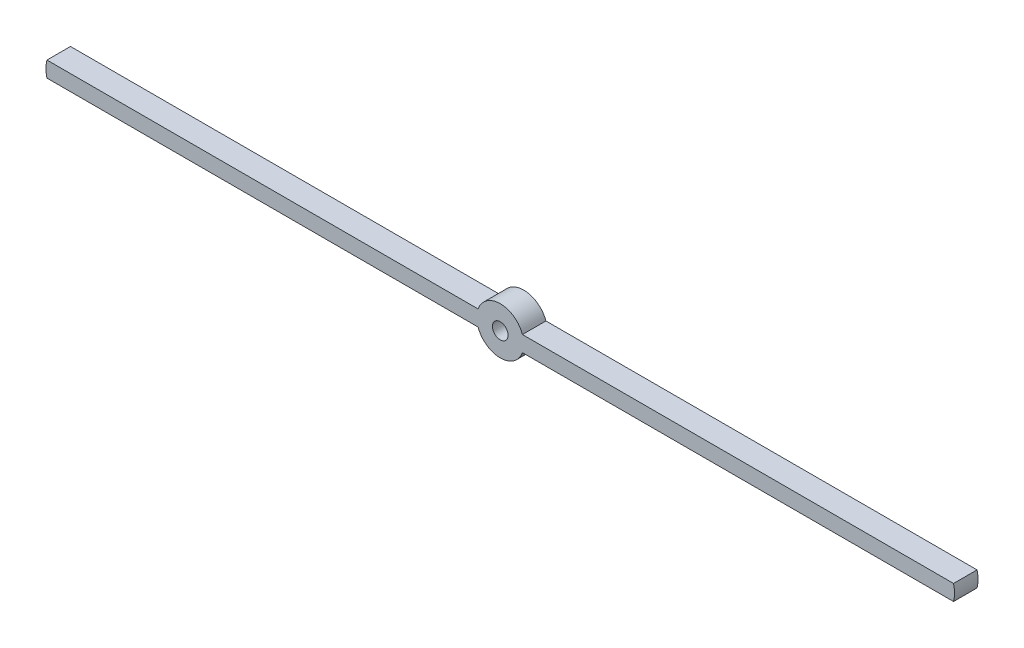
from build123d import *

# Parameters (mm, degrees)
ESQUISSE1_R        = 2
BOSS_EXTRU_1_DEPTH = 6


with BuildPart() as part:
    # Esquisse1 → Boss.-Extru.1 (new body)
    with BuildSketch(Plane.XY):
        with BuildLine():
            Line((-5.656854249, 2), (-115.656854249, 2))
            ThreePointArc((-115.656854249, 2), (-115.910887557, 0), (-115.656854249, -2))
            Line((-115.656854249, -2), (-5.656854249, -2))
            ThreePointArc((-5.656854249, -2), (0, -6), (5.656854249, -2))
            Line((5.656854249, -2), (115.656854249, -2))
            ThreePointArc((115.656854249, -2), (115.910887557, 0), (115.656854249, 2))
            Line((115.656854249, 2), (5.656854249, 2))
            ThreePointArc((5.656854249, 2), (0, 6), (-5.656854249, 2))
        make_face()
        Circle(ESQUISSE1_R, mode=Mode.SUBTRACT)
    extrude(amount=BOSS_EXTRU_1_DEPTH)


solid = part.part
